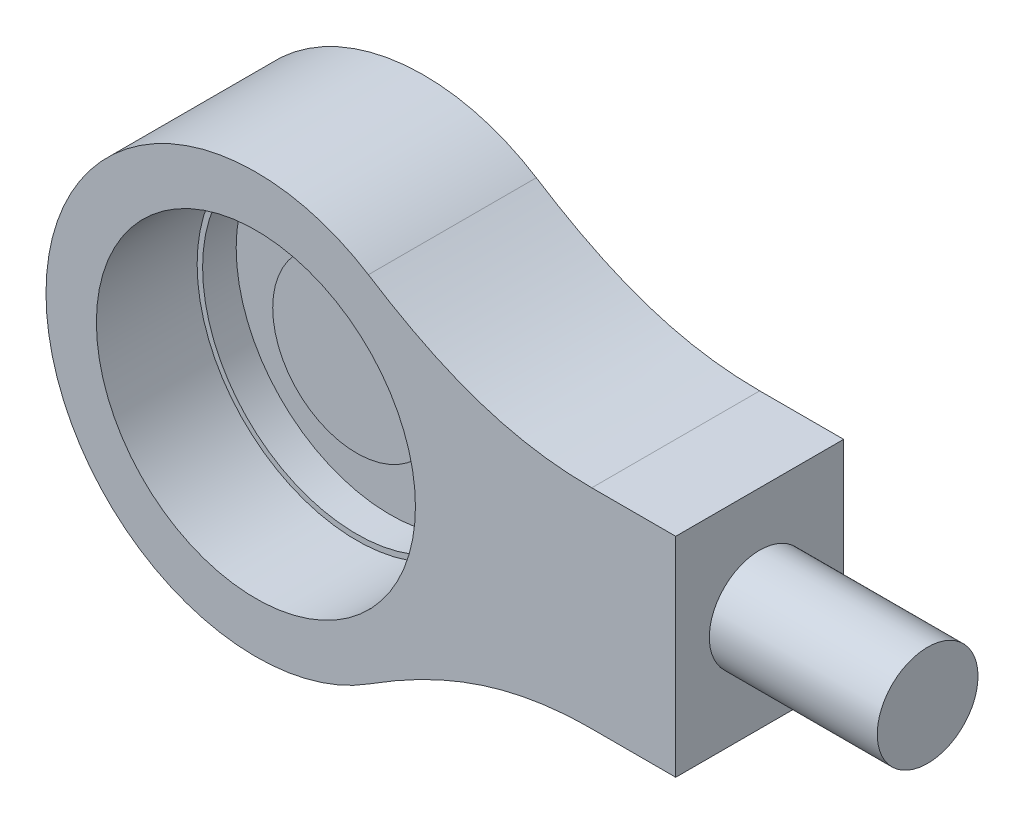
from build123d import *

# Parameters (mm, degrees)
SKETCH1_R           = 9.5
BOSS_EXTRUDE1_DEPTH = 10
SKETCH2_R           = 12.5
BOSS_EXTRUDE2_DEPTH = 2
SKETCH3_R           = 5
BOSS_EXTRUDE3_DEPTH = 4
SKETCH4_R           = 12.5
SKETCH4_R_2         = 9.175
BOSS_EXTRUDE5_DEPTH = 4
SKETCH5_R           = 3
BOSS_EXTRUDE6_DEPTH = 10


with BuildPart() as part:
    # Sketch1 → Boss-Extrude1 (new body)
    with BuildSketch(Plane.XY):
        with BuildLine():
            Line((20, 6.21521961), (25, 6.21521961))
            Line((25, 6.21521961), (25, -6.21521961))
            Line((25, -6.21521961), (20, -6.21521961))
            add(Edge.make_bspline(
                [(20, -6.21521961), (14.928036397, -6.21521961), (10.891454701, -7.892862666), (6.69762749, -10.554230716)],
                knots=[0, 0, 0, 0, 1, 1, 1, 1], degree=3))
            ThreePointArc((6.69762749, -10.554230716), (-12.5, 0), (6.69762749, 10.554230716))
            add(Edge.make_bspline(
                [(20, 6.21521961), (14.928036397, 6.21521961), (10.891454701, 7.892862666), (6.69762749, 10.554230716)],
                knots=[0, 0, 0, 0, 1, 1, 1, 1], degree=3))
        make_face()
        Circle(SKETCH1_R, mode=Mode.SUBTRACT)
    extrude(amount=BOSS_EXTRUDE1_DEPTH)

    # Sketch2 → Boss-Extrude2 (add)
    with BuildSketch(Plane(origin=(0, 0, 0), x_dir=(-1, 0, 0), z_dir=(0, 0, -1))):
        Circle(SKETCH2_R)
    extrude(amount=-BOSS_EXTRUDE2_DEPTH)

    # Sketch3 → Boss-Extrude3 (add)
    with BuildSketch(Plane(origin=(0, 0, 0), x_dir=(-1, 0, 0), z_dir=(0, 0, -1))):
        Circle(SKETCH3_R)
    extrude(amount=-BOSS_EXTRUDE3_DEPTH)

    # Sketch4 → Boss-Extrude5 (add)
    with BuildSketch(Plane(origin=(0, 0, 0), x_dir=(-1, 0, 0), z_dir=(0, 0, -1))):
        Circle(SKETCH4_R)
        Circle(SKETCH4_R_2, mode=Mode.SUBTRACT)
    extrude(amount=-BOSS_EXTRUDE5_DEPTH)

    # Sketch5 → Boss-Extrude6 (add)
    with BuildSketch(Plane(origin=(25, 0, 0), x_dir=(0, 0, -1), z_dir=(1, 0, 0))):
        with Locations((-5, 0)):
            Circle(SKETCH5_R)
    extrude(amount=BOSS_EXTRUDE6_DEPTH)


solid = part.part
